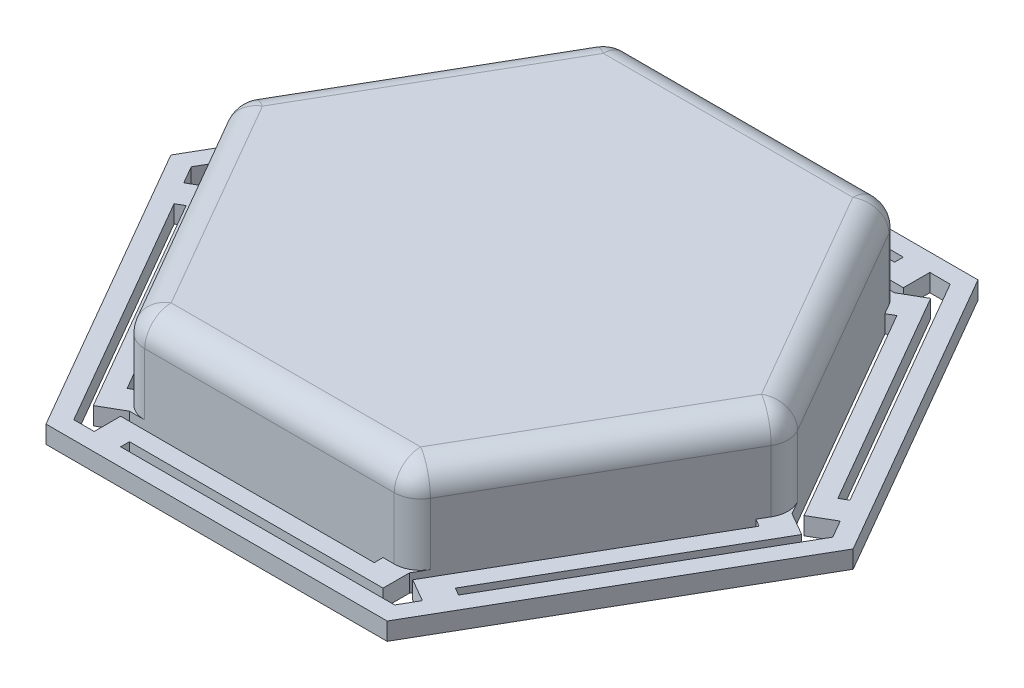
from build123d import *

# Parameters (mm, degrees)
BOSS_EXTRUDE2_DEPTH = 2.54
BOSS_EXTRUDE3_DEPTH = 12.7
CUT_EXTRUDE1_DEPTH  = 13.97
FILLET1_R           = 3.8099999999999996


with BuildPart() as part:
    # Sketch1 → Boss-Extrude2 (new body)
    with BuildSketch(Plane(origin=(0, 0, 0), x_dir=(1, 0, 0), z_dir=(0, 1, 0))):
        Polygon((49.12673440534523, 7.27e-15), (24.56336720267261, 42.545), (-24.56336720267263, 42.544999999999995), (-49.12673440534525, -4.56e-15), (-24.56336720267264, -42.545), (24.56336720267261, -42.545), align=None)
        Polygon((-23.09689751893098, 40.004999999999995), (-24.56336720267272, 37.465000000000906), (-21.263810414254024, 35.560000000000905), (-39.522768565701696, 3.9345567884195773), (-38.42291630289545, 3.299556788419578), (-20.163958151447684, 34.925), (-20.163958151447687, 38.735), (16.353958151447667, 38.735), (16.353958151447667, 40.004999999999995), align=None, mode=Mode.SUBTRACT)
        Polygon((20.1639581514492, -34.92499999999734), (38.42291630289649, -3.299556788416705), (39.52276856570363, -3.934556788417227), (21.263810414255218, -35.55999999999977), (24.56336720267305, -37.464999999999264), (23.096897518930962, -40.004999999999995), (-16.353958151447596, -40.0049999999992), (-16.353958151447596, -38.7350000000008), (20.1639581514492, -38.7350000000008), align=None, mode=Mode.SUBTRACT)
        Polygon((40.32791630289463, 1.40742e-12), (22.06895815144691, 31.625443211581366), (23.168810414254217, 32.26044321158198), (41.42776856570169, 0.6350000000010452), (44.727325354119536, 2.540000000000058), (46.19379503786194, 0), (26.468367202673054, -34.16544321158055), (25.368514939866817, -33.53044321158055), (43.62747309131447, -1.9049999999993157), align=None, mode=Mode.SUBTRACT)
        Polygon((20.16395815144767, 34.925), (-16.35395815144768, 34.925), (-16.35395815144768, 36.195), (20.16395815144767, 36.195), (20.163958151447673, 40.004999999999995), (23.096897518930962, 40.004999999999995), (42.82232535411953, 5.839556788418761), (41.7224730913133, 5.204556788418767), (23.4635149398656, 36.83000000000007), align=None, mode=Mode.SUBTRACT)
        Polygon((-40.32791630289535, 3.53e-15), (-22.068958151447685, -31.6254432115805), (-23.168810414253926, -32.26044321158051), (-41.427768565701626, -0.634999999999201), (-44.72732535412034, -2.5399999999991967), (-46.19379503786196, -8.7e-16), (-26.468367202672724, 34.16544321158219), (-25.368514939866504, 33.530443211582195), (-43.62747309131417, 1.9050000000008698), align=None, mode=Mode.SUBTRACT)
        Polygon((-20.163958151444543, -34.92499999999999), (16.35395815144779, -34.924999999999194), (16.353958151447785, -36.19500000000081), (-20.1639581514476, -36.19500000000081), (-20.1639581514476, -40.00499999999919), (-23.09689751893098, -40.004999999999995), (-42.82232535412034, -5.839556788417916), (-41.72247309131411, -5.204556788417918), (-23.46351493986529, -36.83000000000117), align=None, mode=Mode.SUBTRACT)
    extrude(amount=BOSS_EXTRUDE2_DEPTH)

    # Sketch2 → Boss-Extrude3 (add)
    with BuildSketch(Plane(origin=(0, 2.54, 0), x_dir=(1, 0, 0), z_dir=(0, 1, 0))):
        Polygon((-20.163958151447684, 34.925), (-40.32791630289537, -2.429e-14), (-20.163958151447673, -34.92500000000001), (20.163958151447694, -34.92500000000001), (40.32791630289537, 2.74e-15), (20.163958151447677, 34.925), align=None)
    extrude(amount=BOSS_EXTRUDE3_DEPTH)

    # Sketch3 → Cut-Extrude1 (cut)
    with BuildSketch(Plane.XZ):
        Polygon((17.23101878396438, -29.844999999999995), (34.46203756792874, 9.8e-15), (17.231018783964352, 29.845000000000006), (-17.231018783964387, 29.845000000000002), (-34.46203756792876, -6.96e-15), (-17.231018783964384, -29.84499999999999), align=None)
    extrude(amount=-CUT_EXTRUDE1_DEPTH, mode=Mode.SUBTRACT)

    # Fillet1
    fillet1_edges = [part.edges().sort_by_distance(p)[0] for p in [
        (20.163958151447677, 8.89, -34.925),
        (-20.163958151447684, 8.89, -34.925),
        (-40.32791630289537, 8.89, 2.429e-14),
        (-20.163958151447673, 8.89, 34.92500000000001),
        (20.163958151447694, 8.89, 34.92500000000001),
        (40.32791630289537, 8.89, -2.74e-15),
        (-3.55e-15, 15.239999999999998, -34.925),
        (-30.245937227171524, 15.239999999999998, -17.462499999999988),
        (-30.24593722717152, 15.239999999999998, 17.46250000000002),
        (1.066e-14, 15.239999999999998, 34.92500000000001),
        (30.24593722717153, 15.239999999999998, 17.462500000000006),
        (30.245937227171524, 15.239999999999998, -17.462500000000002),
    ]]
    fillet(fillet1_edges, radius=FILLET1_R)


solid = part.part
